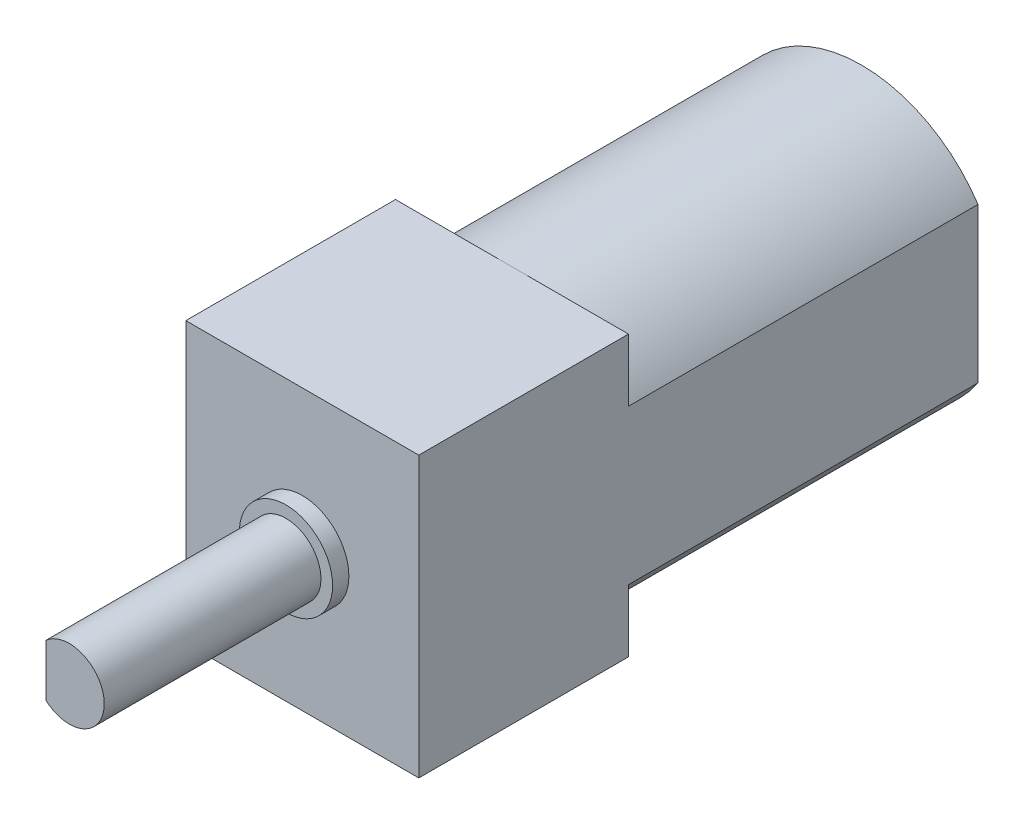
from build123d import *

# Parameters (mm, degrees)
EXTRUDE_1_DEPTH     = 24
SKETCH_2_R          = 2.5
EXTRUDE_2_DEPTH     = 1.2
SKETCH_3_R          = 2
EXTRUDE_3_DEPTH     = 0.7
SKETCH_5_R          = 1.5
EXTRUDE_5_DEPTH     = 9.3
SKETCH_6_R          = 8.807991622
SKETCH_6_R_2        = 6
CUT_EXTRUDE_1_DEPTH = 15
CUT_EXTRUDE_2_DEPTH = 9.3


with BuildPart() as part:
    # 草图1 → 凸台-拉伸1 (new body)
    with BuildSketch(Plane.XY):
        Polygon((5, 0), (5, 6), (-5, 6), (-5, -6), (5, -6), align=None)
    extrude(amount=EXTRUDE_1_DEPTH)

    # 草图2 → 凸台-拉伸2 (add)
    with BuildSketch(Plane(origin=(0, 0, 0), x_dir=(-1, 0, 0), z_dir=(0, 0, -1))):
        Circle(SKETCH_2_R)
    extrude(amount=EXTRUDE_2_DEPTH)

    # 草图3 → 凸台-拉伸3 (add)
    with BuildSketch(Plane.XY.offset(24)):
        Circle(SKETCH_3_R)
    extrude(amount=EXTRUDE_3_DEPTH)

    # 草图5 → 凸台-拉伸5 (add)
    with BuildSketch(Plane.XY.offset(24.7)):
        Circle(SKETCH_5_R)
    extrude(amount=EXTRUDE_5_DEPTH)

    # 草图6 → 切除-拉伸1 (cut)
    with BuildSketch(Plane(origin=(0, 0, 0), x_dir=(-1, 0, 0), z_dir=(0, 0, -1))):
        Circle(SKETCH_6_R)
        Circle(SKETCH_6_R_2, mode=Mode.SUBTRACT)
    extrude(amount=-CUT_EXTRUDE_1_DEPTH, mode=Mode.SUBTRACT)

    # 草图7 → 切除-拉伸2 (cut)
    with BuildSketch(Plane.XY.offset(34)):
        Polygon((-1, 0), (-1, 3.342262846), (-2.573415309, 3.342262846), (-2.573415309, -2.211230932), (-1, -2.211230932), align=None)
    extrude(amount=-CUT_EXTRUDE_2_DEPTH, mode=Mode.SUBTRACT)


solid = part.part
